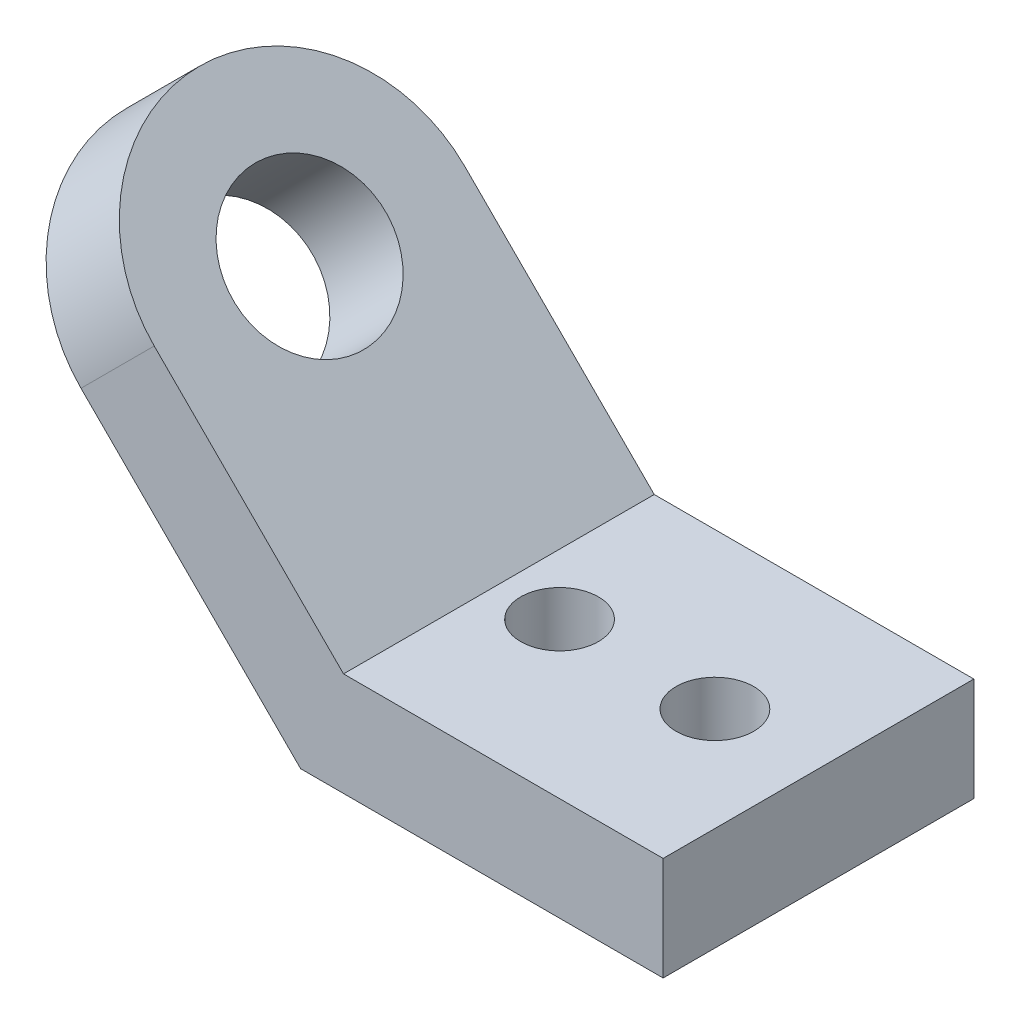
from build123d import *

# Parameters (mm, degrees)
BOSS_EXTRUDE1_DEPTH = 152.4
SKETCH2_R           = 76.2
BOSS_EXTRUDE2_DEPTH = 50.8
SKETCH3_R           = 37.465
CUT_EXTRUDE1_DEPTH  = 50.8
SKETCH4_R           = 19.05
CUT_EXTRUDE2_DEPTH  = 50.8


with BuildPart() as part:
    # Sketch1 → Boss-Extrude1 (new body)
    with BuildSketch(Plane.XY):
        Polygon((0, 0), (156.757951031, 0), (156.757951031, -50.8), (-21.042048969, -50.8), (-128.776872776, 56.934823808), (-92.855848292, 92.855848292), align=None)
    extrude(amount=-BOSS_EXTRUDE1_DEPTH)

    # Sketch2 → Boss-Extrude2 (add)
    with BuildSketch(Plane(origin=(0, 0, 0), x_dir=(0, 0, -1), z_dir=(0.7071067811865486, 0.7071067811865465, 0))):
        with Locations((76.2, 131.318)):
            Circle(SKETCH2_R)
    extrude(amount=-BOSS_EXTRUDE2_DEPTH)

    # Sketch3 → Cut-Extrude1 (cut)
    with BuildSketch(Plane(origin=(0, 0, 0), x_dir=(0, 0, -1), z_dir=(0.7071067811865495, 0.7071067811865457, 0))):
        with Locations(Location((76.2, 131.318, 0), (0, 0, 90))):
            Circle(SKETCH3_R)
    extrude(amount=-CUT_EXTRUDE1_DEPTH, mode=Mode.SUBTRACT)

    # Sketch4 → Cut-Extrude2 (cut)
    with BuildSketch(Plane(origin=(0, 0, 0), x_dir=(1, 0, 0), z_dir=(0, 1, 0))):
        with Locations(Location((29.757951031, 76.2, 0), (0, 0, 270))):
            Circle(SKETCH4_R)
        with Locations(Location((105.957951031, 76.2, 0), (0, 0, 270))):
            Circle(SKETCH4_R)
    extrude(amount=-CUT_EXTRUDE2_DEPTH, mode=Mode.SUBTRACT)


solid = part.part
